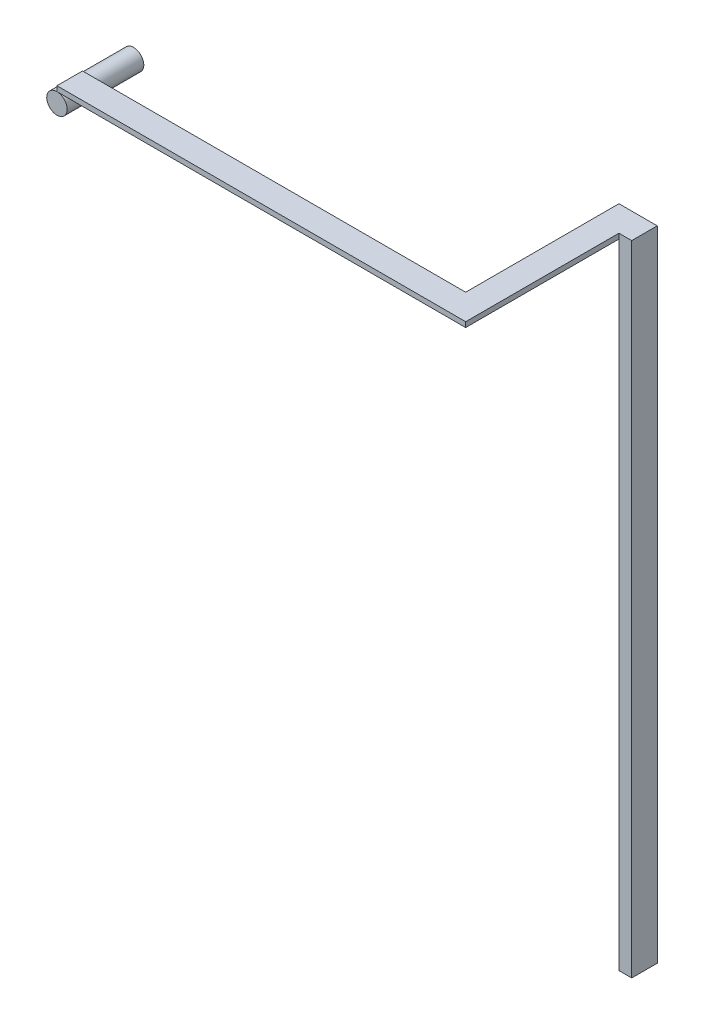
from build123d import *

# Parameters (mm, degrees)
SKETCH1_R           = 4
BOSS_EXTRUDE1_DEPTH = 30
SKETCH2_W           = 160
SKETCH2_H           = 2
BOSS_EXTRUDE2_DEPTH = 10
SKETCH3_W           = 10
SKETCH3_H           = 2
BOSS_EXTRUDE3_DEPTH = 60
SKETCH5_W           = 10
SKETCH5_H           = 250
BOSS_EXTRUDE5_DEPTH = 5


with BuildPart() as part:
    # Sketch1 → Boss-Extrude1 (new body)
    with BuildSketch(Plane.XY):
        Circle(SKETCH1_R)
    extrude(amount=BOSS_EXTRUDE1_DEPTH)


with BuildPart() as body_2:
    # Sketch2 → Boss-Extrude2 (new body)
    with BuildSketch(Plane.XY.offset(30)):
        with Locations((80, 5)):
            Rectangle(SKETCH2_W, SKETCH2_H)
    extrude(amount=-BOSS_EXTRUDE2_DEPTH)

    # Sketch3 → Boss-Extrude3 (add)
    with BuildSketch(Plane(origin=(0, 0, 20), x_dir=(-1, 0, 0), z_dir=(0, 0, -1))):
        with Locations((-155, 5)):
            Rectangle(SKETCH3_W, SKETCH3_H)
    extrude(amount=BOSS_EXTRUDE3_DEPTH)

    # Sketch5 → Boss-Extrude5 (add)
    with BuildSketch(Plane(origin=(160, 0, 0), x_dir=(0, 0, -1), z_dir=(1, 0, 0))):
        with Locations((35, -119)):
            Rectangle(SKETCH5_W, SKETCH5_H)
    extrude(amount=BOSS_EXTRUDE5_DEPTH)


solid = Compound([part.part, body_2.part])
